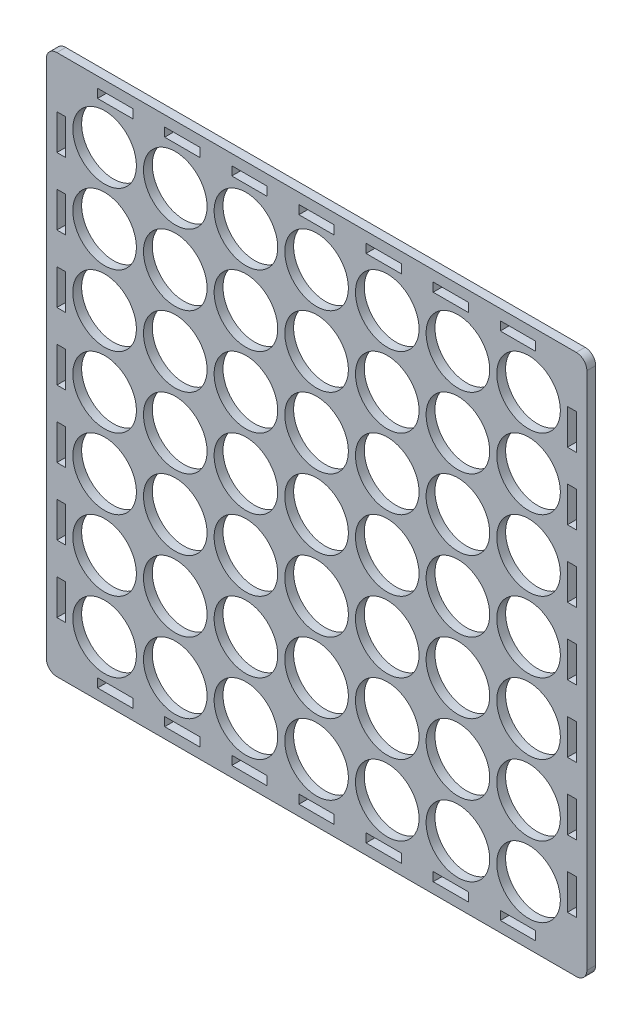
from build123d import *

# Parameters (mm, degrees)
SKETCH1_W           = 153
SKETCH1_H           = 153
SKETCH1_W_2         = 2.5
SKETCH1_H_2         = 10
SKETCH1_W_3         = 10
SKETCH1_H_3         = 2.5
BOSS_EXTRUDE1_DEPTH = 2.5
SKETCH2_R           = 9
CUT_EXTRUDE1_DEPTH  = 2.5
FILLET1_R           = 3


with BuildPart() as part:
    # Sketch1 → Boss-Extrude1 (new body)
    with BuildSketch(Plane.XY):
        Rectangle(SKETCH1_W, SKETCH1_H)
        with Locations((-72.25, 57)):
            Rectangle(SKETCH1_W_2, SKETCH1_H_2, mode=Mode.SUBTRACT)
        with Locations((-72.25, 38)):
            Rectangle(SKETCH1_W_2, SKETCH1_H_2, mode=Mode.SUBTRACT)
        with Locations((-72.25, 19)):
            Rectangle(SKETCH1_W_2, SKETCH1_H_2, mode=Mode.SUBTRACT)
        with Locations((-72.25, 0)):
            Rectangle(SKETCH1_W_2, SKETCH1_H_2, mode=Mode.SUBTRACT)
        with Locations((-72.25, -19)):
            Rectangle(SKETCH1_W_2, SKETCH1_H_2, mode=Mode.SUBTRACT)
        with Locations((-72.25, -38)):
            Rectangle(SKETCH1_W_2, SKETCH1_H_2, mode=Mode.SUBTRACT)
        with Locations((-72.25, -57)):
            Rectangle(SKETCH1_W_2, SKETCH1_H_2, mode=Mode.SUBTRACT)
        with Locations((72.25, -19)):
            Rectangle(SKETCH1_W_2, SKETCH1_H_2, mode=Mode.SUBTRACT)
        with Locations((72.25, -38)):
            Rectangle(SKETCH1_W_2, SKETCH1_H_2, mode=Mode.SUBTRACT)
        with Locations((72.25, -57)):
            Rectangle(SKETCH1_W_2, SKETCH1_H_2, mode=Mode.SUBTRACT)
        with Locations((72.25, 0)):
            Rectangle(SKETCH1_W_2, SKETCH1_H_2, mode=Mode.SUBTRACT)
        with Locations((72.25, 19)):
            Rectangle(SKETCH1_W_2, SKETCH1_H_2, mode=Mode.SUBTRACT)
        with Locations((72.25, 38)):
            Rectangle(SKETCH1_W_2, SKETCH1_H_2, mode=Mode.SUBTRACT)
        with Locations((72.25, 57)):
            Rectangle(SKETCH1_W_2, SKETCH1_H_2, mode=Mode.SUBTRACT)
        with Locations((-57, -72.25)):
            Rectangle(SKETCH1_W_3, SKETCH1_H_3, mode=Mode.SUBTRACT)
        with Locations((-57, 72.25)):
            Rectangle(SKETCH1_W_3, SKETCH1_H_3, mode=Mode.SUBTRACT)
        with Locations((-38, 72.25)):
            Rectangle(SKETCH1_W_3, SKETCH1_H_3, mode=Mode.SUBTRACT)
        with Locations((-38, -72.25)):
            Rectangle(SKETCH1_W_3, SKETCH1_H_3, mode=Mode.SUBTRACT)
        with Locations((-19, 72.25)):
            Rectangle(SKETCH1_W_3, SKETCH1_H_3, mode=Mode.SUBTRACT)
        with Locations((-19, -72.25)):
            Rectangle(SKETCH1_W_3, SKETCH1_H_3, mode=Mode.SUBTRACT)
        with Locations((0, 72.25)):
            Rectangle(SKETCH1_W_3, SKETCH1_H_3, mode=Mode.SUBTRACT)
        with Locations((0, -72.25)):
            Rectangle(SKETCH1_W_3, SKETCH1_H_3, mode=Mode.SUBTRACT)
        with Locations((19, 72.25)):
            Rectangle(SKETCH1_W_3, SKETCH1_H_3, mode=Mode.SUBTRACT)
        with Locations((19, -72.25)):
            Rectangle(SKETCH1_W_3, SKETCH1_H_3, mode=Mode.SUBTRACT)
        with Locations((38, 72.25)):
            Rectangle(SKETCH1_W_3, SKETCH1_H_3, mode=Mode.SUBTRACT)
        with Locations((38, -72.25)):
            Rectangle(SKETCH1_W_3, SKETCH1_H_3, mode=Mode.SUBTRACT)
        with Locations((57, 72.25)):
            Rectangle(SKETCH1_W_3, SKETCH1_H_3, mode=Mode.SUBTRACT)
        with Locations((57, -72.25)):
            Rectangle(SKETCH1_W_3, SKETCH1_H_3, mode=Mode.SUBTRACT)
    extrude(amount=BOSS_EXTRUDE1_DEPTH)

    # Sketch2 → Cut-Extrude1 (cut)
    with BuildSketch(Plane.XY.offset(2.5)):
        with Locations((60, 60)):
            Circle(SKETCH2_R)
        with Locations((40, 60)):
            Circle(SKETCH2_R)
        with Locations((20, 60)):
            Circle(SKETCH2_R)
        with Locations((0, 60)):
            Circle(SKETCH2_R)
        with Locations((-20, 60)):
            Circle(SKETCH2_R)
        with Locations((-40, 60)):
            Circle(SKETCH2_R)
        with Locations((-60, 60)):
            Circle(SKETCH2_R)
        with Locations((40, 40)):
            Circle(SKETCH2_R)
        with Locations((20, 40)):
            Circle(SKETCH2_R)
        with Locations((0, 40)):
            Circle(SKETCH2_R)
        with Locations((-20, 40)):
            Circle(SKETCH2_R)
        with Locations((-40, 40)):
            Circle(SKETCH2_R)
        with Locations((-60, 40)):
            Circle(SKETCH2_R)
        with Locations((40, 20)):
            Circle(SKETCH2_R)
        with Locations((20, 20)):
            Circle(SKETCH2_R)
        with Locations((0, 20)):
            Circle(SKETCH2_R)
        with Locations((-20, 20)):
            Circle(SKETCH2_R)
        with Locations((-40, 20)):
            Circle(SKETCH2_R)
        with Locations((-60, 20)):
            Circle(SKETCH2_R)
        with Locations((40, 0)):
            Circle(SKETCH2_R)
        with Locations((20, 0)):
            Circle(SKETCH2_R)
        Circle(SKETCH2_R)
        with Locations((-20, 0)):
            Circle(SKETCH2_R)
        with Locations((-40, 0)):
            Circle(SKETCH2_R)
        with Locations((-60, 0)):
            Circle(SKETCH2_R)
        with Locations((40, -20)):
            Circle(SKETCH2_R)
        with Locations((20, -20)):
            Circle(SKETCH2_R)
        with Locations((0, -20)):
            Circle(SKETCH2_R)
        with Locations((-20, -20)):
            Circle(SKETCH2_R)
        with Locations((-40, -20)):
            Circle(SKETCH2_R)
        with Locations((-60, -20)):
            Circle(SKETCH2_R)
        with Locations((40, -40)):
            Circle(SKETCH2_R)
        with Locations((20, -40)):
            Circle(SKETCH2_R)
        with Locations((0, -40)):
            Circle(SKETCH2_R)
        with Locations((-20, -40)):
            Circle(SKETCH2_R)
        with Locations((-40, -40)):
            Circle(SKETCH2_R)
        with Locations((-60, -40)):
            Circle(SKETCH2_R)
        with Locations((40, -60)):
            Circle(SKETCH2_R)
        with Locations((20, -60)):
            Circle(SKETCH2_R)
        with Locations((0, -60)):
            Circle(SKETCH2_R)
        with Locations((-20, -60)):
            Circle(SKETCH2_R)
        with Locations((-40, -60)):
            Circle(SKETCH2_R)
        with Locations((-60, -60)):
            Circle(SKETCH2_R)
        with Locations((60, 40)):
            Circle(SKETCH2_R)
        with Locations((60, 20)):
            Circle(SKETCH2_R)
        with Locations((60, 0)):
            Circle(SKETCH2_R)
        with Locations((60, -20)):
            Circle(SKETCH2_R)
        with Locations((60, -40)):
            Circle(SKETCH2_R)
        with Locations((60, -60)):
            Circle(SKETCH2_R)
    extrude(amount=-CUT_EXTRUDE1_DEPTH, mode=Mode.SUBTRACT)

    # Fillet1
    fillet1_edges = [part.edges().sort_by_distance(p)[0] for p in [
        (-76.5, -76.5, 1.25),
        (-76.5, 76.5, 1.25),
        (76.5, 76.5, 1.25),
        (76.5, -76.5, 1.25),
    ]]
    fillet(fillet1_edges, radius=FILLET1_R)


solid = part.part
